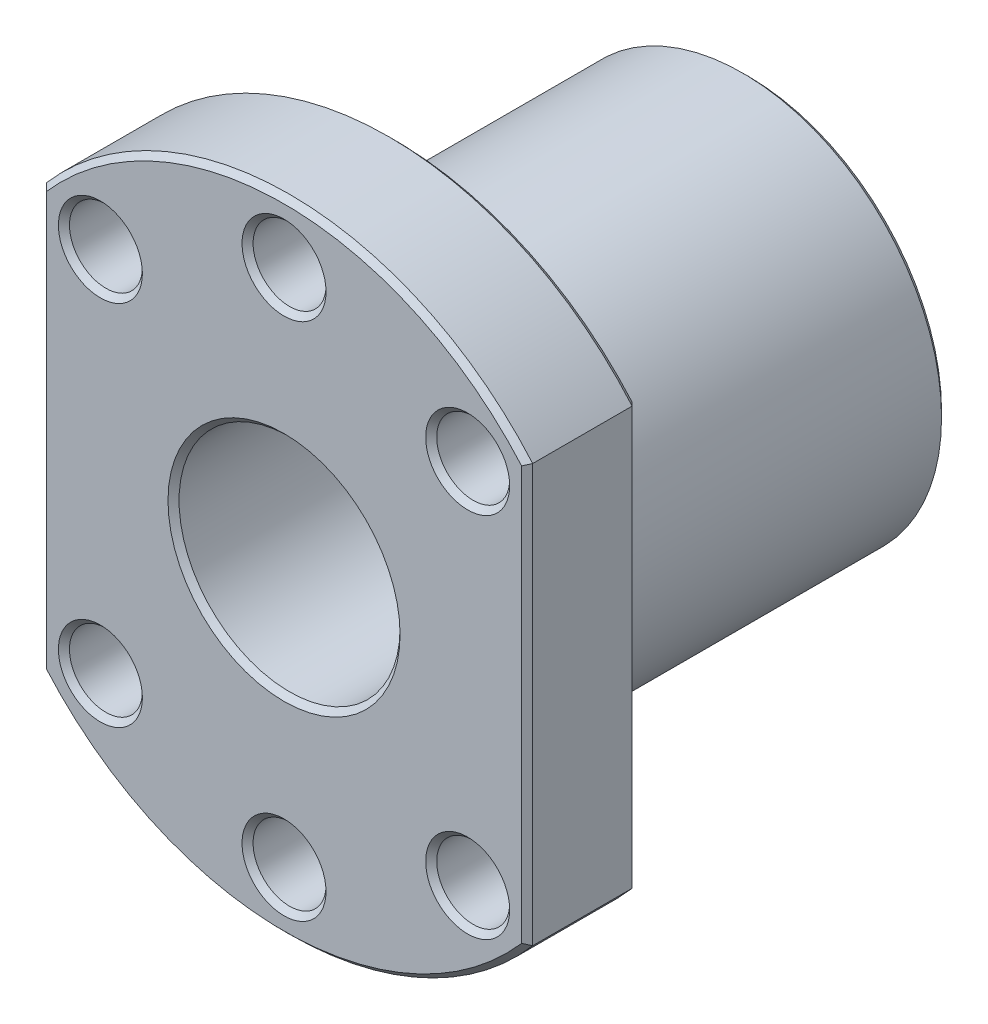
from build123d import *

# Parameters (mm, degrees)
SKETCH1_R           = 10
SKETCH1_R_2         = 3.3
BOSS_EXTRUDE1_DEPTH = 10
BOSS_EXTRUDE2_START = 32
SKETCH3_R           = 18
SKETCH3_R_2         = 10
BOSS_EXTRUDE2_DEPTH = 32
CHAMFER1_SIZE       = 0.5


with BuildPart() as part:
    # Sketch1 → Boss-Extrude1 (new body)
    with BuildSketch(Plane(origin=(0, 0, 0), x_dir=(0, -1, 0), z_dir=(0, 0, 1))):
        with BuildLine():
            Line((-18.894443628, 22), (18.894443628, 22))
            ThreePointArc((18.894443628, 22), (29, 0), (18.894443628, -22))
            Line((18.894443628, -22), (-18.894443628, -22))
            ThreePointArc((-18.894443628, -22), (-29, 0), (-18.894443628, 22))
        make_face()
        with Locations(Location((0, 0, 0), (0, 0, 90))):
            Circle(SKETCH1_R, mode=Mode.SUBTRACT)
        with Locations(Location((-23.5, 0, 0), (0, 0, 90))):
            Circle(SKETCH1_R_2, mode=Mode.SUBTRACT)
        with Locations(Location((-16.617009358, 16.617009358, 0), (0, 0, 90))):
            Circle(SKETCH1_R_2, mode=Mode.SUBTRACT)
        with Locations(Location((16.617009358, 16.617009358, 0), (0, 0, 90))):
            Circle(SKETCH1_R_2, mode=Mode.SUBTRACT)
        with Locations(Location((23.5, 0, 0), (0, 0, 90))):
            Circle(SKETCH1_R_2, mode=Mode.SUBTRACT)
        with Locations(Location((16.617009358, -16.617009358, 0), (0, 0, 90))):
            Circle(SKETCH1_R_2, mode=Mode.SUBTRACT)
        with Locations(Location((-16.617009358, -16.617009358, 0), (0, 0, 90))):
            Circle(SKETCH1_R_2, mode=Mode.SUBTRACT)
    extrude(amount=BOSS_EXTRUDE1_DEPTH)

    # Sketch3 → Boss-Extrude2 (add)
    with BuildSketch(Plane(origin=(0, 0, 0), x_dir=(0, -1, 0), z_dir=(0, 0, -1)).offset(BOSS_EXTRUDE2_START)):
        with Locations(Location((0, 0, 0), (0, 0, 270))):
            Circle(SKETCH3_R)
        with Locations(Location((0, 0, 0), (0, 0, 270))):
            Circle(SKETCH3_R_2, mode=Mode.SUBTRACT)
    extrude(amount=-BOSS_EXTRUDE2_DEPTH)

    # Chamfer1
    chamfer1_edges = [part.edges().sort_by_distance(p)[0] for p in [
        (0, 29, 10),
        (-10, 0, 10),
        (-22, 0, 10),
        (-3.3, 23.5, 0),
        (-3.3, 23.5, 10),
        (13.317009358, 16.617009358, 0),
        (13.317009358, 16.617009358, 10),
        (13.317009358, -16.617009358, 0),
        (13.317009358, -16.617009358, 10),
        (-3.3, -23.5, 0),
        (-3.3, -23.5, 10),
        (-19.917009358, -16.617009358, 0),
        (-19.917009358, -16.617009358, 10),
        (-19.917009358, 16.617009358, 0),
        (-19.917009358, 16.617009358, 10),
        (0, -29, 10),
        (-18, 0, 0),
        (-18, 0, -32),
        (-10, 0, -32),
        (-22, 0, 0),
        (0, 29, 0),
        (22, 0, 0),
        (0, -29, 0),
        (22, 0, 10),
    ]]
    chamfer(chamfer1_edges, length=CHAMFER1_SIZE)


solid = part.part
